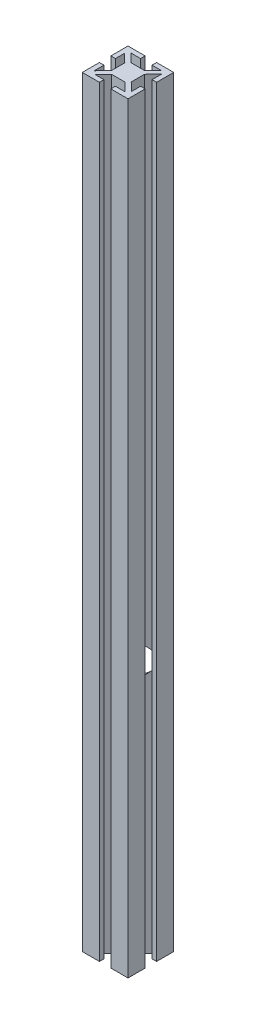
from build123d import *
from build123d.topology import SkipClean

# Parameters (mm, degrees)
SKETCH2_W           = 8.647603028
SKETCH2_H           = 8.647603028
BOSS_EXTRUDE1_DEPTH = 333
SKETCH10_R          = 7
CUT_EXTRUDE5_DEPTH  = 10
SKETCH11_R          = 2
CUT_EXTRUDE6_DEPTH  = 50
SKETCH12_R          = 2
CUT_EXTRUDE7_DEPTH  = 50
SKETCH13_R          = 2
CUT_EXTRUDE8_DEPTH  = 50


with BuildPart() as part:
    # Sketch2 → Boss-Extrude1 (new body)
    with BuildSketch(Plane(origin=(0, 0, 0), x_dir=(1, 0, 0), z_dir=(0, 1, 0))):
        Polygon((-10, -10), (-10, -2.5), (-8, -2.5), (-8, -6.768292683), (-4.358284272, -2.944491169), (-2.91000841, -4.323801514), (-6.424278868, -8), (-2.5, -8), (-2.5, -10), align=None)
        Polygon((-10, 2.5), (-10, 10), (-2.5, 10), (-2.5, 8), (-6.768292683, 8), (-2.944491169, 4.358284272), (-4.323801514, 2.91000841), (-8, 6.424278868), (-8, 2.5), align=None)
        Polygon((2.5, 10), (10, 10), (10, 2.5), (8, 2.5), (8, 6.768292683), (4.358284272, 2.944491169), (2.91000841, 4.323801514), (6.424278868, 8), (2.5, 8), align=None)
        Polygon((10, -2.5), (10, -10), (2.5, -10), (2.5, -8), (6.768292683, -8), (2.944491169, -4.358284272), (4.323801514, -2.91000841), (8, -6.424278868), (8, -2.5), align=None)
        Rectangle(SKETCH2_W, SKETCH2_H)
    extrude(amount=BOSS_EXTRUDE1_DEPTH)

    # Sketch10 → Cut-Extrude5 (cut)
    with SkipClean():  # the faces are left unmerged after this step: merging them gives an invalid solid
        with BuildSketch(Plane(origin=(0, 0, -10), x_dir=(-1, 0, 0), z_dir=(0, 0, -1))):
            with Locations(Location((0, 111, 0), (0, 0, 14.783041233))):
                Circle(SKETCH10_R)
        extrude(amount=-CUT_EXTRUDE5_DEPTH, mode=Mode.SUBTRACT)

    # Sketch11 → Cut-Extrude6 (cut)
    with SkipClean():  # the faces are left unmerged after this step: merging them gives an invalid solid
        with BuildSketch(Plane.XY.offset(10)):
            with Locations(Location((0.033661741, 325, 0), (0, 0, 180))):
                Circle(SKETCH11_R)
        extrude(amount=-CUT_EXTRUDE6_DEPTH, mode=Mode.SUBTRACT)

    # Sketch12 → Cut-Extrude7 (cut)
    with SkipClean():  # the faces are left unmerged after this step: merging them gives an invalid solid
        with BuildSketch(Plane.XY.offset(10)):
            with Locations(Location((0, 111, 0), (0, 0, 180))):
                Circle(SKETCH12_R)
        extrude(amount=-CUT_EXTRUDE7_DEPTH, mode=Mode.SUBTRACT)

    # Sketch13 → Cut-Extrude8 (cut)
    with SkipClean():  # the faces are left unmerged after this step: merging them gives an invalid solid
        with BuildSketch(Plane.XY.offset(10)):
            with Locations(Location((0, 10, 0), (0, 0, 180))):
                Circle(SKETCH13_R)
        extrude(amount=-CUT_EXTRUDE8_DEPTH, mode=Mode.SUBTRACT)


solid = part.part
